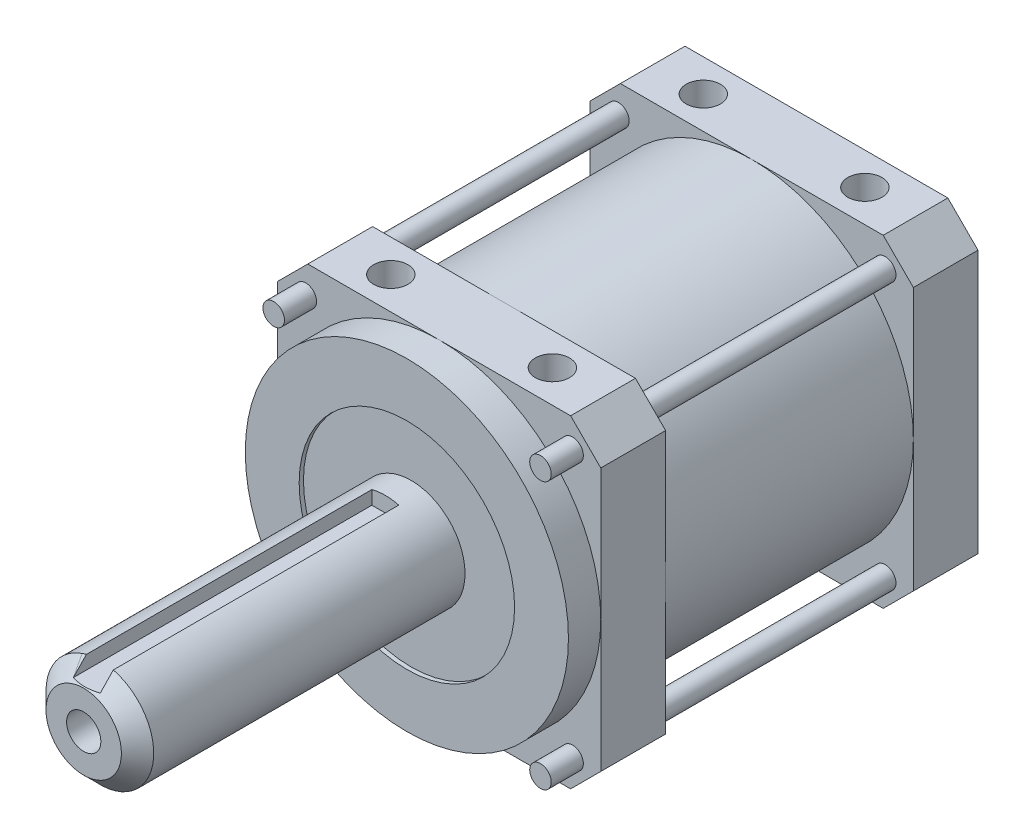
from build123d import *

# Parameters (mm, degrees)
SKETCH1_W                       = 38.1
SKETCH1_H                       = 38.1
BOSS_EXTRUDE1_DEPTH             = 7.62
CHAMFER1_SIZE                   = 3.556
SKETCH2_R                       = 19.05
BOSS_EXTRUDE2_DEPTH             = 29.21
SKETCH3_W                       = 38.1
SKETCH3_H                       = 38.1
BOSS_EXTRUDE3_DEPTH             = 7.6454
CHAMFER2_SIZE                   = 3.556
SKETCH4_R                       = 1.27
BOSS_EXTRUDE4_DEPTH             = 48.26
SKETCH6_R                       = 19.05
BOSS_EXTRUDE6_DEPTH             = 3.81
SKETCH7_R                       = 6.35
BOSS_EXTRUDE7_DEPTH             = 38.1
CHAMFER3_SIZE                   = 1.905
CUT_EXTRUDE2_START              = -0.508
SKETCH8_R                       = 12.7
SKETCH8_R_2                     = 6.35
CUT_EXTRUDE2_DEPTH              = 0.508
F_10_32_TAPPED_HOLE1_D          = 4.0386
F_10_32_TAPPED_HOLE1_DEPTH      = 13.208
F_10_32_TAPPED_HOLE1_TIP        = 1.213317848
F_10_32_TAPPED_HOLE2_AT_2_COUNT = 2
F_10_32_TAPPED_HOLE2_AT_2_PITCH = 19.05
F_10_32_TAPPED_HOLE3_AT_2_COUNT = 2
F_10_32_TAPPED_HOLE3_AT_2_PITCH = 19.05
SKETCH19_W                      = 3.175
SKETCH19_H                      = 3.6068
CUT_EXTRUDE4_DEPTH              = 35.56
SKETCH20_R                      = 4.9022
SKETCH20_R_2                    = 1.4986
CUT_EXTRUDE5_DEPTH              = 5.08


with BuildPart() as part:
    # Sketch1 → Boss-Extrude1 (new body)
    with BuildSketch(Plane.XY):
        Rectangle(SKETCH1_W, SKETCH1_H)
    extrude(amount=BOSS_EXTRUDE1_DEPTH)

    # Chamfer1
    chamfer1_edges = [part.edges().sort_by_distance(p)[0] for p in [
        (19.05, -19.05, 3.81),
        (-19.05, -19.05, 3.81),
        (-19.05, 19.05, 3.81),
        (19.05, 19.05, 3.81),
    ]]
    chamfer(chamfer1_edges, length=CHAMFER1_SIZE)

    # Sketch2 → Boss-Extrude2 (add)
    with BuildSketch(Plane.XY.offset(7.62)):
        Circle(SKETCH2_R)
    extrude(amount=BOSS_EXTRUDE2_DEPTH)

    # Sketch3 → Boss-Extrude3 (add)
    with BuildSketch(Plane.XY.offset(36.83)):
        Rectangle(SKETCH3_W, SKETCH3_H)
    extrude(amount=BOSS_EXTRUDE3_DEPTH)

    # Chamfer2
    chamfer2_edges = [part.edges().sort_by_distance(p)[0] for p in [
        (-19.05, 19.05, 40.6527),
        (-19.05, -19.05, 40.6527),
        (19.05, -19.05, 40.6527),
        (19.05, 19.05, 40.6527),
    ]]
    chamfer(chamfer2_edges, length=CHAMFER2_SIZE)

    # Sketch4 → Boss-Extrude4 (add)
    with BuildSketch(Plane(origin=(0, 0, 0), x_dir=(-1, 0, 0), z_dir=(0, 0, -1))):
        with Locations((-15.727395947, 15.727395947)):
            Circle(SKETCH4_R)
        with Locations((15.727395947, 15.727395947)):
            Circle(SKETCH4_R)
        with Locations((15.727395947, -15.727395947)):
            Circle(SKETCH4_R)
        with Locations((-15.727395947, -15.727395947)):
            Circle(SKETCH4_R)
    extrude(amount=-BOSS_EXTRUDE4_DEPTH)

    # Sketch6 → Boss-Extrude6 (add)
    with BuildSketch(Plane.XY.offset(44.4754)):
        with Locations(Location((0, 0, 0), (0, 0, 180))):
            Circle(SKETCH6_R)
    extrude(amount=BOSS_EXTRUDE6_DEPTH)

    # Sketch7 → Boss-Extrude7 (add)
    with BuildSketch(Plane.XY.offset(48.2854)):
        with Locations(Location((0, 0, 0), (0, 0, 180))):
            Circle(SKETCH7_R)
    extrude(amount=BOSS_EXTRUDE7_DEPTH)

    # Chamfer3
    chamfer3_edges = [part.edges().sort_by_distance(p)[0] for p in [
        (6.35, 0, 86.3854),
    ]]
    chamfer(chamfer3_edges, length=CHAMFER3_SIZE)

    # Sketch8 → Cut-Extrude2 (cut)
    with BuildSketch(Plane.XY.offset(48.2854).offset(CUT_EXTRUDE2_START)):
        Circle(SKETCH8_R)
        with Locations(Location((0, 0, 0), (0, 0, 180))):
            Circle(SKETCH8_R_2, mode=Mode.SUBTRACT)
    extrude(amount=CUT_EXTRUDE2_DEPTH, mode=Mode.SUBTRACT)

    # #10-32 Tapped Hole1
    with Locations(Plane.XY.offset(86.3854)):
        with Locations((0, 0)):
            Hole(F_10_32_TAPPED_HOLE1_D / 2, depth=F_10_32_TAPPED_HOLE1_DEPTH)
            with Locations((0, 0, -(F_10_32_TAPPED_HOLE1_DEPTH + F_10_32_TAPPED_HOLE1_TIP / 2))):  # 118° drill point
                Cone(0, F_10_32_TAPPED_HOLE1_D / 2, F_10_32_TAPPED_HOLE1_TIP, mode=Mode.SUBTRACT)

    # Sketch14 → #10-32 Tapped Hole2 (revolve, cut)
    with BuildSketch(Plane(origin=(9.525, 19.05, 40.6527), x_dir=(0, 0, 1), z_dir=(1, 0, 0))):
        Polygon((0, 0), (0, 11.373317848), (2.0193, 10.16), (2.0193, 0), align=None)
    f_10_32_tapped_hole2 = revolve(axis=Axis((9.525, 25.4, 40.6527), (0, -1, 0)), mode=Mode.SUBTRACT)

    # #10-32 Tapped Hole2 at 2: #10-32 Tapped Hole2 ×2
    with Locations(*[(-i * F_10_32_TAPPED_HOLE2_AT_2_PITCH, 0, 0) for i in range(1, F_10_32_TAPPED_HOLE2_AT_2_COUNT)]):
        add(f_10_32_tapped_hole2, mode=Mode.SUBTRACT)

    # Sketch17 → #10-32 Tapped Hole3 (revolve, cut)
    with BuildSketch(Plane(origin=(9.525, 19.05, 3.81), x_dir=(0, 0, 1), z_dir=(1, 0, 0))):
        Polygon((0, 0), (0, 12.643317848), (2.0193, 11.43), (2.0193, 0), align=None)
    f_10_32_tapped_hole3 = revolve(axis=Axis((9.525, 25.4, 3.81), (0, -1, 0)), mode=Mode.SUBTRACT)

    # #10-32 Tapped Hole3 at 2: #10-32 Tapped Hole3 ×2
    with Locations(*[(-i * F_10_32_TAPPED_HOLE3_AT_2_PITCH, 0, 0) for i in range(1, F_10_32_TAPPED_HOLE3_AT_2_COUNT)]):
        add(f_10_32_tapped_hole3, mode=Mode.SUBTRACT)

    # Mirror1: #10-32 Tapped Hole2, #10-32 Tapped Hole3 across plane
    add(f_10_32_tapped_hole2.mirror(Plane.ZX), mode=Mode.SUBTRACT)
    add(f_10_32_tapped_hole3.mirror(Plane.ZX), mode=Mode.SUBTRACT)

    # Mirror1 copy 1 sketch → Mirror1 copy 1 (revolve, cut)
    with BuildSketch(Plane(origin=(-9.525, -19.05, 40.6527), x_dir=(0, 0, 1), z_dir=(1, 0, 0))):
        Polygon((0, 0), (0, -11.373317848), (2.0193, -10.16), (2.0193, 0), align=None)
    revolve(axis=Axis((-9.525, -25.4, 40.6527), (0, -1, 0)), mode=Mode.SUBTRACT)

    # Mirror1 copy 2 sketch → Mirror1 copy 2 (revolve, cut)
    with BuildSketch(Plane(origin=(-9.525, -19.05, 3.81), x_dir=(0, 0, 1), z_dir=(1, 0, 0))):
        Polygon((0, 0), (0, -12.643317848), (2.0193, -11.43), (2.0193, 0), align=None)
    revolve(axis=Axis((-9.525, -25.4, 3.81), (0, -1, 0)), mode=Mode.SUBTRACT)

    # Sketch19 → Cut-Extrude4 (cut)
    with BuildSketch(Plane.XY.offset(86.3854)):
        with Locations((0, 6.35)):
            Rectangle(SKETCH19_W, SKETCH19_H)
    extrude(amount=-CUT_EXTRUDE4_DEPTH, mode=Mode.SUBTRACT)

    # Sketch20 → Cut-Extrude5 (cut)
    with BuildSketch(Plane(origin=(0, 0, 0), x_dir=(-1, 0, 0), z_dir=(0, 0, -1))):
        Circle(SKETCH20_R)
        with Locations((0, 7.6708)):
            Circle(SKETCH20_R_2)
        with Locations((0, -7.6708)):
            Circle(SKETCH20_R_2)
    extrude(amount=-CUT_EXTRUDE5_DEPTH, mode=Mode.SUBTRACT)


solid = part.part
